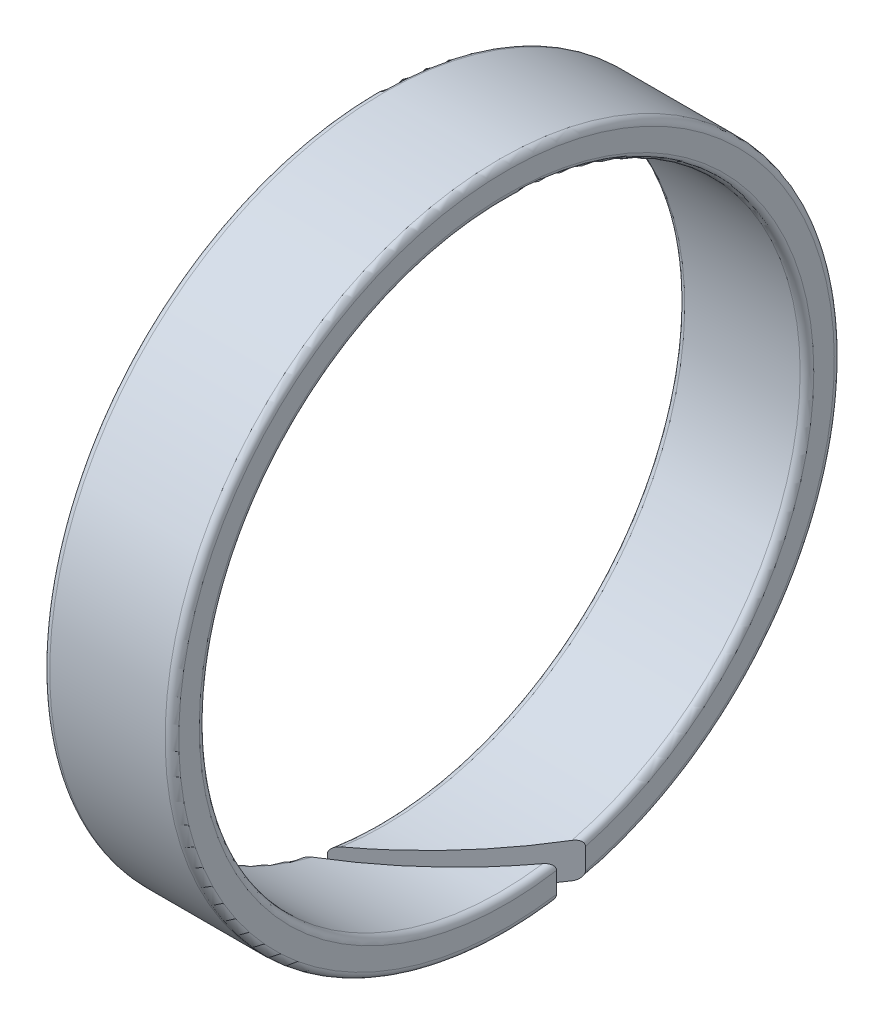
from build123d import *

# Parameters (mm, degrees)
SKETCH1_R      = 24.5
SKETCH1_R_2    = 22
EXTRUDE1_DEPTH = 4.725
EXTRUDE2_DEPTH = 35.968923704
FILLET1_R      = 0.5


with BuildPart() as part:
    # Sketch1 → Extrude1 (new, symmetric)
    with BuildSketch(Plane(origin=(0, 0, 0), x_dir=(0, 0, -1), z_dir=(1, 0, 0))):
        Circle(SKETCH1_R)
        Circle(SKETCH1_R_2, mode=Mode.SUBTRACT)
    extrude(amount=EXTRUDE1_DEPTH, both=True)

    # Sketch2 → Extrude2 (cut, through all)
    with BuildSketch(Plane(origin=(0, 0, 0), x_dir=(1, 0, 0), z_dir=(0, 1, 0))):
        Polygon((4.725, 5.785660172), (-5.720642465, -4.659982293), (-4.659982293, -5.720642465), (5.785660172, 4.725), align=None)
    extrude(amount=-EXTRUDE2_DEPTH, mode=Mode.SUBTRACT)

    # Fillet1
    fillet1_edges = [part.edges().sort_by_distance(p)[0] for p in [
        (-4.725, 19.219948056, 15.193537992),
        (-4.725, 17.441670572, 13.408509524),
        (4.725, 14.201840088, 16.802015894),
        (4.725, 15.976133359, 18.574529951),
    ]]
    fillet(fillet1_edges, radius=FILLET1_R)


solid = part.part
